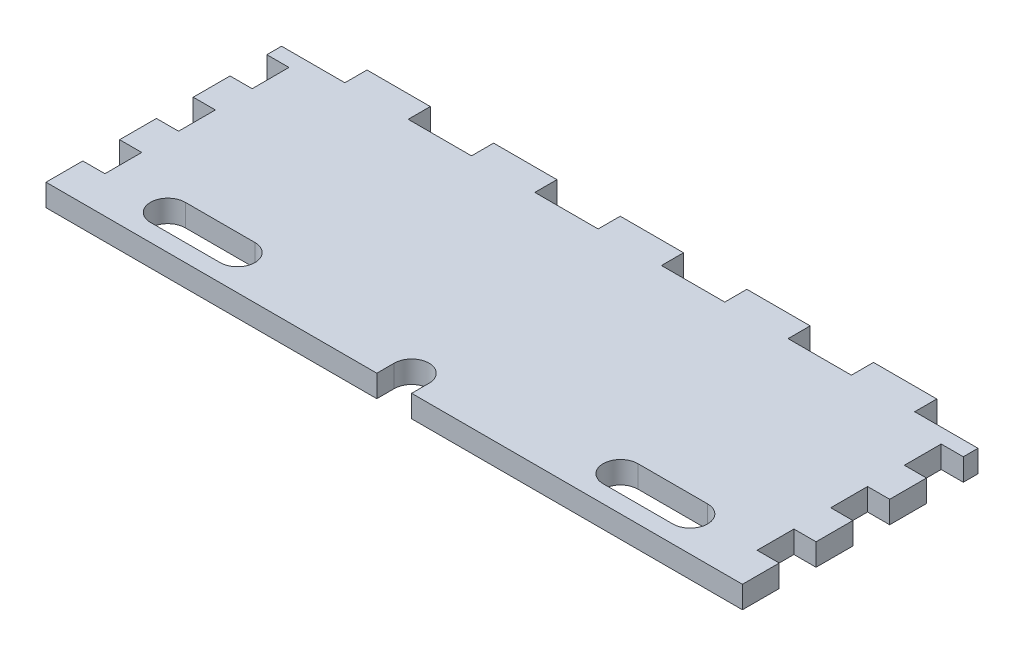
from build123d import *

# Parameters (mm, degrees)
ESQUISSE1_W             = 200
ESQUISSE1_H             = 74
BOSS_EXTRU_1_DEPTH      = 6.35
ESQUISSE3_W             = 6.35
ESQUISSE3_H             = 10.571428572
ENL_V_MAT_EXTRU_1_DEPTH = 6.35
ESQUISSE4_W             = 18.181818182
ESQUISSE4_H             = 6.35
ESQUISSE4_W_2           = 18.181818181
ENL_V_MAT_EXTRU_2_DEPTH = 6.35
ENL_V_MAT_EXTRU_3_DEPTH = 6.35
ENL_V_MAT_EXTRU_4_DEPTH = 6.35


with BuildPart() as part:
    # Esquisse1 → Boss.-Extru.1 (new body)
    with BuildSketch(Plane(origin=(0, 0, 0), x_dir=(1, 0, 0), z_dir=(0, 1, 0))):
        with Locations((0, 37)):
            Rectangle(ESQUISSE1_W, ESQUISSE1_H)
    extrude(amount=BOSS_EXTRU_1_DEPTH)

    # Esquisse3 → Enlèv. mat.-Extru.1 (cut)
    with BuildSketch(Plane(origin=(0, 6.35, 0), x_dir=(1, 0, 0), z_dir=(0, 1, 0))):
        with Locations((-96.825, 15.857142857)):
            Rectangle(ESQUISSE3_W, ESQUISSE3_H)
        with Locations((-96.825, 37)):
            Rectangle(ESQUISSE3_W, ESQUISSE3_H)
        with Locations((-96.825, 58.142857143)):
            Rectangle(ESQUISSE3_W, ESQUISSE3_H)
    enl_v_mat_extru_1 = extrude(amount=-ENL_V_MAT_EXTRU_1_DEPTH, mode=Mode.SUBTRACT)

    # Symétrie1: Enlèv. mat.-Extru.1 across plane
    add(enl_v_mat_extru_1.mirror(Plane(origin=(0, 0, 0), x_dir=(0, 0, 1), z_dir=(1, 0, 0))), mode=Mode.SUBTRACT)

    # Esquisse4 → Enlèv. mat.-Extru.2 (cut)
    with BuildSketch(Plane(origin=(0, 6.35, 0), x_dir=(1, 0, 0), z_dir=(0, 1, 0))):
        with Locations((-90.909090909, 70.825)):
            Rectangle(ESQUISSE4_W, ESQUISSE4_H)
        with Locations((-54.545454546, 70.825)):
            Rectangle(ESQUISSE4_W_2, ESQUISSE4_H)
        with Locations((-18.181818182, 70.825)):
            Rectangle(ESQUISSE4_W, ESQUISSE4_H)
        with Locations((18.181818182, 70.825)):
            Rectangle(ESQUISSE4_W, ESQUISSE4_H)
        with Locations((54.545454546, 70.825)):
            Rectangle(ESQUISSE4_W_2, ESQUISSE4_H)
        with Locations((90.909090909, 70.825)):
            Rectangle(ESQUISSE4_W, ESQUISSE4_H)
    extrude(amount=-ENL_V_MAT_EXTRU_2_DEPTH, mode=Mode.SUBTRACT)

    # Esquisse5 → Enlèv. mat.-Extru.3 (cut)
    with BuildSketch(Plane(origin=(0, 6.35, 0), x_dir=(1, 0, 0), z_dir=(0, 1, 0))):
        with BuildLine():
            Line((-75, 15), (-55, 15))
            ThreePointArc((-55, 15), (-50, 10), (-55, 5))
            Line((-55, 5), (-75, 5))
            ThreePointArc((-75, 5), (-80, 10), (-75, 15))
        make_face()
    enl_v_mat_extru_3 = extrude(amount=-ENL_V_MAT_EXTRU_3_DEPTH, mode=Mode.SUBTRACT)

    # Symétrie2: Enlèv. mat.-Extru.3 across plane
    add(enl_v_mat_extru_3.mirror(Plane(origin=(0, 0, 0), x_dir=(0, 0, 1), z_dir=(1, 0, 0))), mode=Mode.SUBTRACT)

    # Esquisse6 → Enlèv. mat.-Extru.4 (cut)
    with BuildSketch(Plane.XZ):
        with BuildLine():
            Line((-5, 0), (-5, -5))
            ThreePointArc((-5, -5), (0, -10), (5, -5))
            Line((5, -5), (5, 0))
            Line((5, 0), (-5, 0))
        make_face()
    extrude(amount=-ENL_V_MAT_EXTRU_4_DEPTH, mode=Mode.SUBTRACT)


solid = part.part
